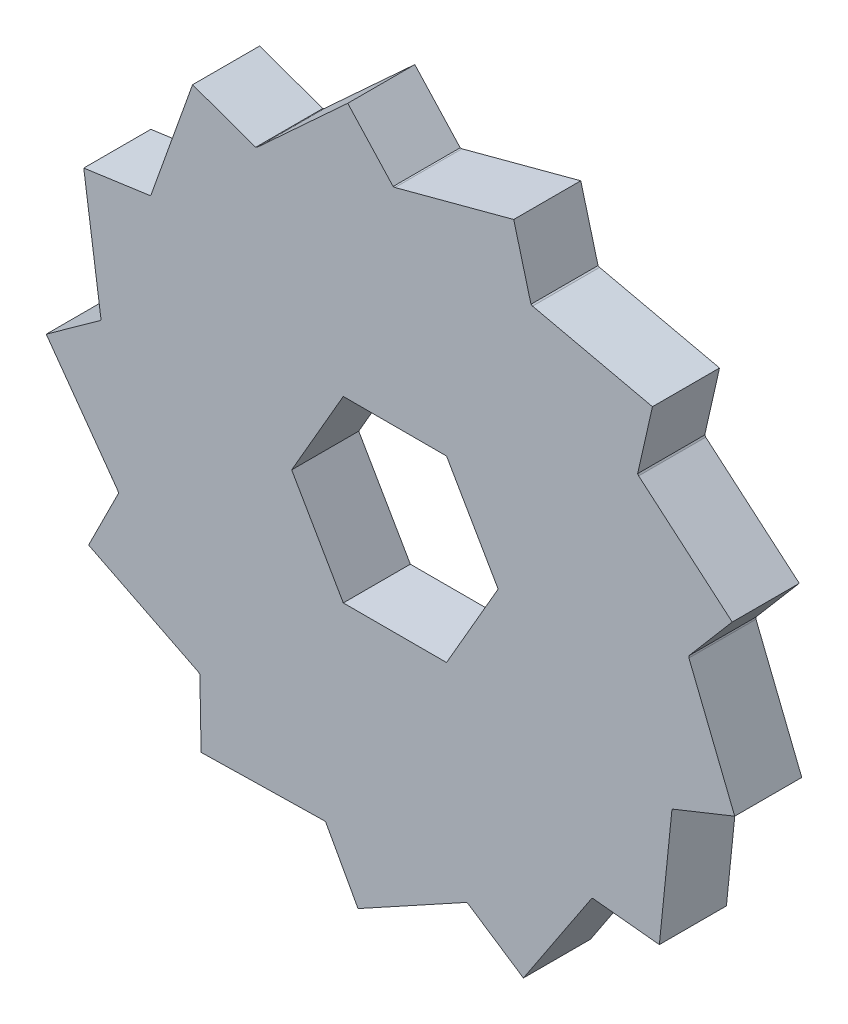
from build123d import *

# Parameters (mm, degrees)
BOSS_EXTRUDE1_DEPTH = 4.7625
CUT_EXTRUDE1_DEPTH  = 4.7625


with BuildPart() as part:
    # Sketch1 → Boss-Extrude1 (new body)
    with BuildSketch(Plane.XY):
        with BuildLine():
            Line((0, 21.034375), (8.436280557, 23.284685407))
            Line((8.436280557, 23.284685407), (9.663722597, 18.68307783))
            ThreePointArc((9.663722597, 18.68307783), (9.719485393, 18.654129176), (9.775161472, 18.62501409))
            Line((9.775161472, 18.62501409), (18.290888316, 16.697029938))
            Line((18.290888316, 16.697029938), (17.239260597, 12.052088023))
            ThreePointArc((17.239260597, 12.052088023), (17.27518299, 12.000541), (17.310951254, 11.948886907))
            Line((17.310951254, 11.948886907), (23.95527399, 6.284286132))
            Line((23.95527399, 6.284286132), (20.865491749, 2.660110094))
            ThreePointArc((20.865491749, 2.660110094), (20.873344353, 2.597773503), (20.881010724, 2.535413734))
            Line((20.881010724, 2.535413734), (24.131795086, -5.568111894))
            Line((24.131795086, -5.568111894), (19.711690198, -7.341267))
            ThreePointArc((19.711690198, -7.341267), (19.689674075, -7.400112598), (19.66748228, -7.458892171))
            Line((19.66748228, -7.458892171), (18.780012747, -16.144922587))
            Line((18.780012747, -16.144922587), (14.042177975, -15.660848297))
            ThreePointArc((14.042177975, -15.660848297), (13.995336753, -15.702722083), (13.948370664, -15.744455769))
            Line((13.948370664, -15.744455769), (9.125955812, -23.023126083))
            Line((9.125955812, -23.023126083), (5.155772004, -20.392717982))
            ThreePointArc((5.155772004, -20.392717982), (5.094836443, -20.408027177), (5.033855426, -20.423154291))
            Line((5.033855426, -20.423154291), (-2.61874762, -24.627008853))
            Line((-2.61874762, -24.627008853), (-4.9117592, -20.452861736))
            ThreePointArc((-4.9117592, -20.452861736), (-4.972829497, -20.438099188), (-5.033855426, -20.423154291))
            Line((-5.033855426, -20.423154291), (-13.763527532, -20.589140681))
            Line((-13.763527532, -20.589140681), (-13.854065563, -15.827501351))
            ThreePointArc((-13.854065563, -15.827501351), (-13.901280128, -15.786048982), (-13.948370664, -15.744455769))
            Line((-13.948370664, -15.744455769), (-21.755249155, -11.834548506))
            Line((-21.755249155, -11.834548506), (-19.622572466, -7.576251148))
            ThreePointArc((-19.622572466, -7.576251148), (-19.64511501, -7.517605196), (-19.66748228, -7.458892171))
            Line((-19.66748228, -7.458892171), (-24.763105375, -0.36880389))
            Line((-24.763105375, -0.36880389), (-20.895784495, 2.410626889))
            ThreePointArc((-20.895784495, 2.410626889), (-20.888490793, 2.473031344), (-20.881010724, 2.535413734))
            Line((-20.881010724, 2.535413734), (-22.098032582, 11.181429253))
            Line((-22.098032582, 11.181429253), (-17.382024117, 11.845259357))
            ThreePointArc((-17.382024117, 11.845259357), (-17.346565069, 11.897126206), (-17.310951254, 11.948886907))
            Line((-17.310951254, 11.948886907), (-14.370566834, 20.170131705))
            Line((-14.370566834, 20.170131705), (-9.88625149, 18.566285658))
            ThreePointArc((-9.88625149, 18.566285658), (-9.830750336, 18.59573283), (-9.775161472, 18.62501409))
            Line((-9.775161472, 18.62501409), (-3.350977409, 24.53810006))
            Line((-3.350977409, 24.53810006), (-0.125657789, 21.033999662))
            ThreePointArc((-0.125657789, 21.033999662), (-0.062829175, 21.034281165), (0, 21.034375))
        make_face()
    extrude(amount=BOSS_EXTRUDE1_DEPTH)

    # Sketch2 → Cut-Extrude1 (cut)
    with BuildSketch(Plane(origin=(0, 0, 0), x_dir=(-1, 0, 0), z_dir=(0, 0, -1))):
        Polygon((-7.332348419, 0), (-3.666174209, -6.35), (3.666174209, -6.35), (7.332348419, 0), (3.666174209, 6.35), (-3.666174209, 6.35), align=None)
    extrude(amount=-CUT_EXTRUDE1_DEPTH, mode=Mode.SUBTRACT)


solid = part.part
